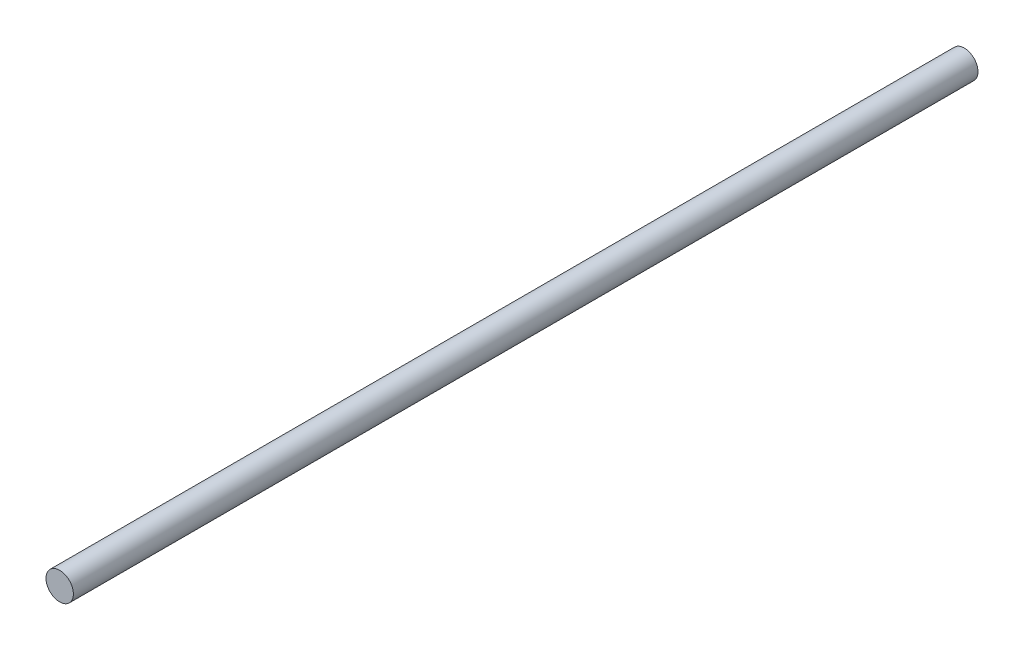
from build123d import *

# Parameters (mm, degrees)
SKETCH1_R           = 4
BOSS_EXTRUDE1_DEPTH = 264


with BuildPart() as part:
    # Sketch1 → Boss-Extrude1 (new body)
    with BuildSketch(Plane.XY):
        Circle(SKETCH1_R)
    extrude(amount=BOSS_EXTRUDE1_DEPTH)


solid = part.part
